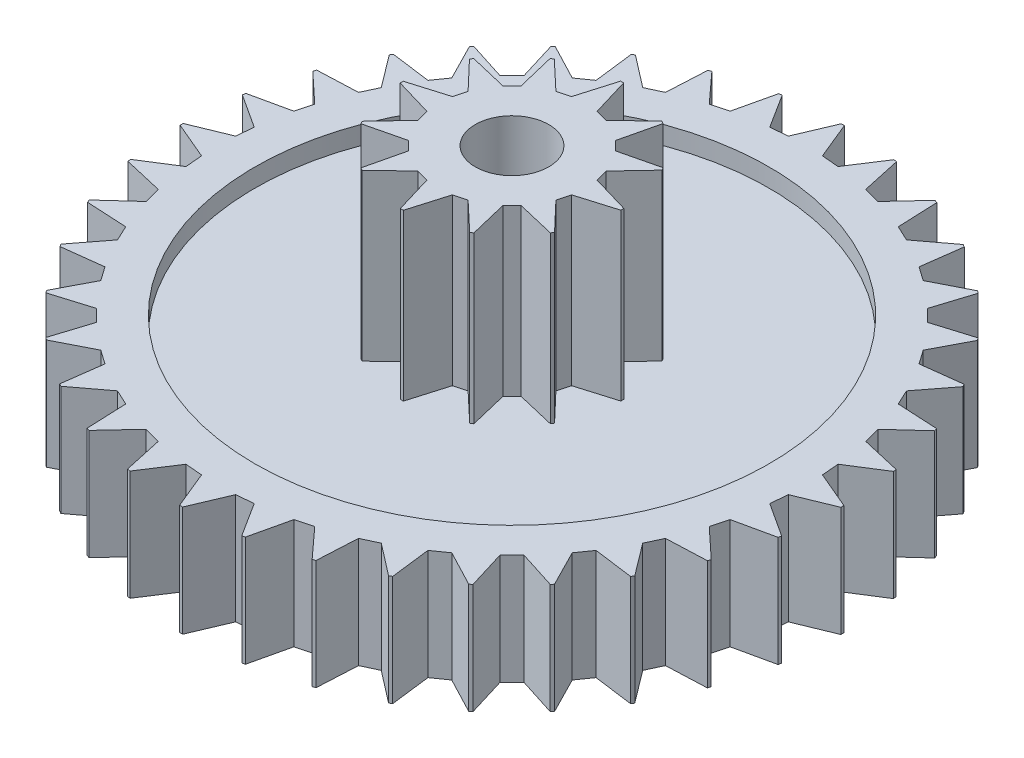
from build123d import *

# Parameters (mm, degrees)
SKETCH2_R           = 4.5
BOSS_EXTRUDE1_DEPTH = 1.5
CUT_EXTRUDE1_DEPTH  = 7.538348415
CIRPATTERN1_COUNT   = 36
SKETCH6_R           = 3.5
CUT_EXTRUDE2_DEPTH  = 0.25
SKETCH7_R           = 0.5
CUT_EXTRUDE3_DEPTH  = 7.538348415
CUT_EXTRUDE4_START  = -0.25
SKETCH8_R           = 3.5
SKETCH8_R_2         = 1
CUT_EXTRUDE4_DEPTH  = 0.25
SKETCH9_R           = 1.5
BOSS_EXTRUDE2_DEPTH = 2.25
SKETCH10_R          = 0.5
CUT_EXTRUDE5_DEPTH  = 8.262919523
CUT_EXTRUDE6_DEPTH  = 2.25
CIRPATTERN2_COUNT   = 12


with BuildPart() as part:
    # Sketch2 → Boss-Extrude1 (new body)
    with BuildSketch(Plane(origin=(0, 0, 0), x_dir=(1, 0, 0), z_dir=(0, 1, 0))):
        with Locations(Location((0, 0, 0), (0, 0, 270))):
            Circle(SKETCH2_R)
    extrude(amount=BOSS_EXTRUDE1_DEPTH)

    # Sketch4 → Cut-Extrude1 (cut, through all)
    with BuildSketch(Plane(origin=(0, 1.5, 0), x_dir=(1, 0, 0), z_dir=(0, 1, 0))):
        Polygon((0.232579316, 3.993232633), (0, 4.558789127), (0.788499869, 4.471804974), (0.464371657, 3.972953431), align=None)
    cut_extrude1 = extrude(amount=-CUT_EXTRUDE1_DEPTH, mode=Mode.SUBTRACT)

    # CirPattern1: Cut-Extrude1 ×36 about axis
    cirpattern1_axis = Axis((0, 0, 0), (0, 1, 0))
    for i in range(1, CIRPATTERN1_COUNT):
        add(cut_extrude1.rotate(cirpattern1_axis, i * 360 / CIRPATTERN1_COUNT), mode=Mode.SUBTRACT)

    # Sketch6 → Cut-Extrude2 (cut)
    with BuildSketch(Plane(origin=(0, 1.5, 0), x_dir=(1, 0, 0), z_dir=(0, 1, 0))):
        with Locations(Location((0, 0, 0), (0, 0, 270))):
            Circle(SKETCH6_R)
    extrude(amount=-CUT_EXTRUDE2_DEPTH, mode=Mode.SUBTRACT)

    # Sketch7 → Cut-Extrude3 (cut, through all)
    with BuildSketch(Plane(origin=(0, 1.5, 0), x_dir=(1, 0, 0), z_dir=(0, 1, 0))):
        with Locations(Location((0, 0, 0), (0, 0, 270))):
            Circle(SKETCH7_R)
    extrude(amount=-CUT_EXTRUDE3_DEPTH, mode=Mode.SUBTRACT)

    # Sketch8 → Cut-Extrude4 (cut)
    with BuildSketch(Plane(origin=(0, 0, 0), x_dir=(-1, 0, 0), z_dir=(0, -1, 0)).offset(CUT_EXTRUDE4_START)):
        with Locations(Location((0, 0, 0), (0, 0, 270))):
            Circle(SKETCH8_R)
        with Locations(Location((0, 0, 0), (0, 0, 90))):
            Circle(SKETCH8_R_2, mode=Mode.SUBTRACT)
    extrude(amount=CUT_EXTRUDE4_DEPTH, mode=Mode.SUBTRACT)

    # Sketch9 → Boss-Extrude2 (add)
    with BuildSketch(Plane(origin=(0, 1.25, 0), x_dir=(1, 0, 0), z_dir=(0, 1, 0))):
        with Locations(Location((0, 0, 0), (0, 0, 270))):
            Circle(SKETCH9_R)
    extrude(amount=BOSS_EXTRUDE2_DEPTH)

    # Sketch10 → Cut-Extrude5 (cut, through all)
    with BuildSketch(Plane(origin=(0, 3.5, 0), x_dir=(1, 0, 0), z_dir=(0, 1, 0))):
        with Locations(Location((0, 0, 0), (0, 0, 270))):
            Circle(SKETCH10_R)
    extrude(amount=-CUT_EXTRUDE5_DEPTH, mode=Mode.SUBTRACT)

    # Sketch11 → Cut-Extrude6 (cut)
    with BuildSketch(Plane(origin=(0, 3.5, 0), x_dir=(1, 0, 0), z_dir=(0, 1, 0))):
        Polygon((-0.984807753, 0.173648178), (-1.565317225, 0), (-1.36360311, 0.787276623), (-0.939692621, 0.342020143), align=None)
    cut_extrude6 = extrude(amount=-CUT_EXTRUDE6_DEPTH, mode=Mode.SUBTRACT)

    # CirPattern2: Cut-Extrude6 ×12 about axis
    cirpattern2_axis = Axis((0, 0, 0), (0, 1, 0))
    for i in range(1, CIRPATTERN2_COUNT):
        add(cut_extrude6.rotate(cirpattern2_axis, i * 360 / CIRPATTERN2_COUNT), mode=Mode.SUBTRACT)


solid = part.part
